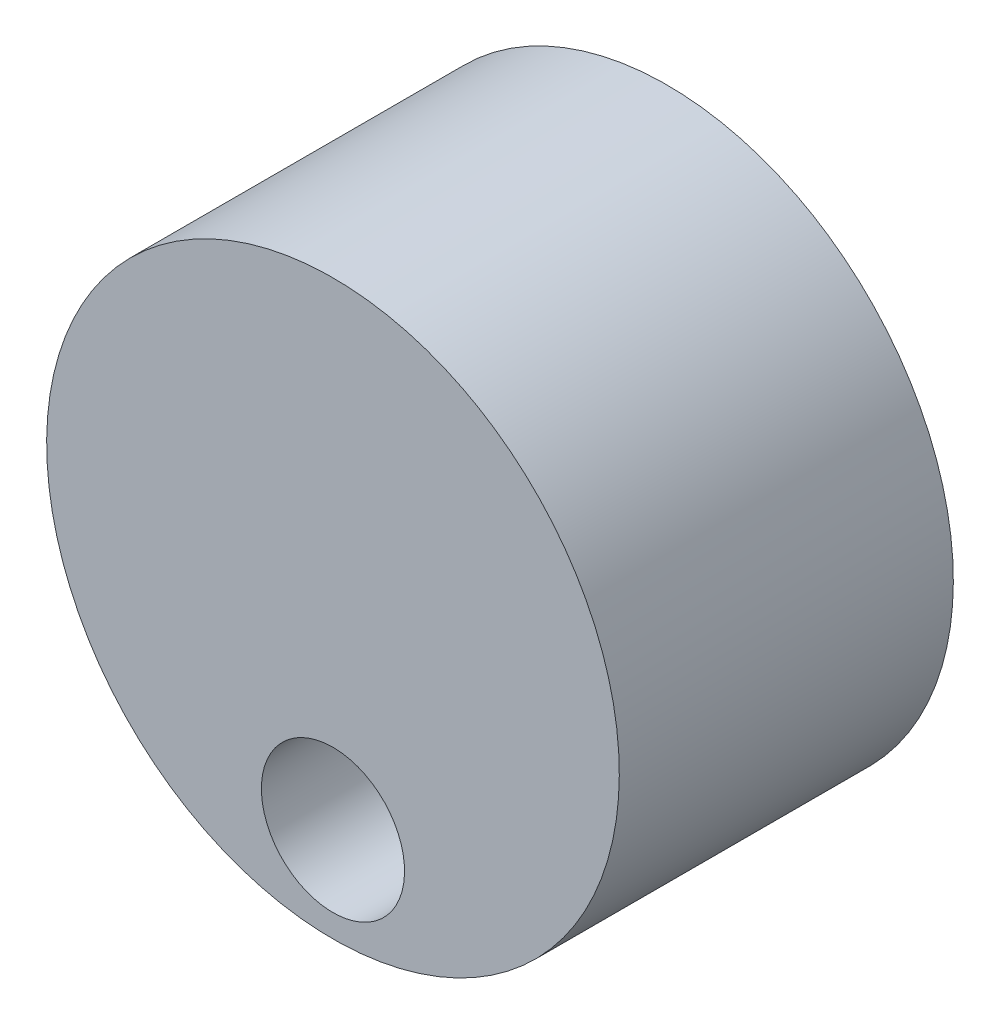
from build123d import *

# Parameters (mm, degrees)
ESQUISSE1_RX       = 12.7
ESQUISSE1_RY       = 12.7
ESQUISSE1_RX_2     = 3.175
ESQUISSE1_RY_2     = 3.175
BOSS_EXTRU_1_DEPTH = 14.81582


with BuildPart() as part:
    # Esquisse1 → Boss.-Extru.1 (new body)
    with BuildSketch(Plane.XY):
        with Locations(Location((0, 0), (0, 0, 63.038901355))):
            Ellipse(ESQUISSE1_RX, ESQUISSE1_RY)
        with Locations(Location((0, -8.509), (0, 0, 124.414368361))):
            Ellipse(ESQUISSE1_RX_2, ESQUISSE1_RY_2, mode=Mode.SUBTRACT)
    extrude(amount=BOSS_EXTRU_1_DEPTH)


solid = part.part
